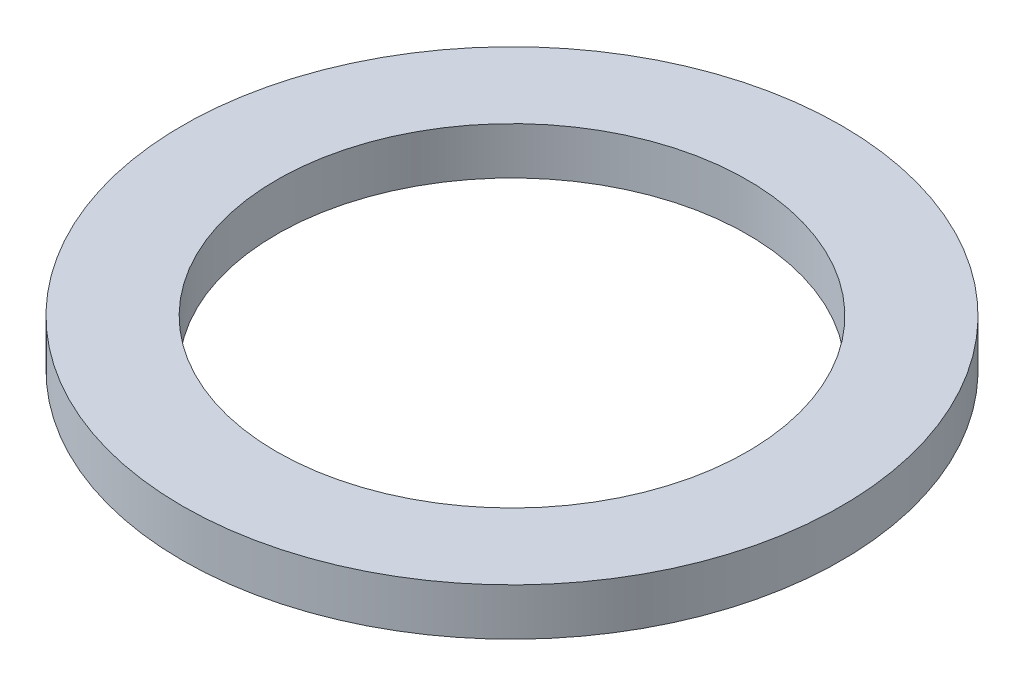
from build123d import *

# Parameters (mm, degrees)
SKETCH1_R           = 3.5
SKETCH1_R_2         = 2.5
BOSS_EXTRUDE1_DEPTH = 0.25


with BuildPart() as part:
    # Sketch1 → Boss-Extrude1 (new, symmetric)
    with BuildSketch(Plane(origin=(0, 0, 0), x_dir=(1, 0, 0), z_dir=(0, 1, 0))):
        with Locations(Location((0, 0, 0), (0, 0, 270))):
            Circle(SKETCH1_R)
        with Locations(Location((0, 0, 0), (0, 0, 270))):
            Circle(SKETCH1_R_2, mode=Mode.SUBTRACT)
    extrude(amount=BOSS_EXTRUDE1_DEPTH, both=True)


solid = part.part
